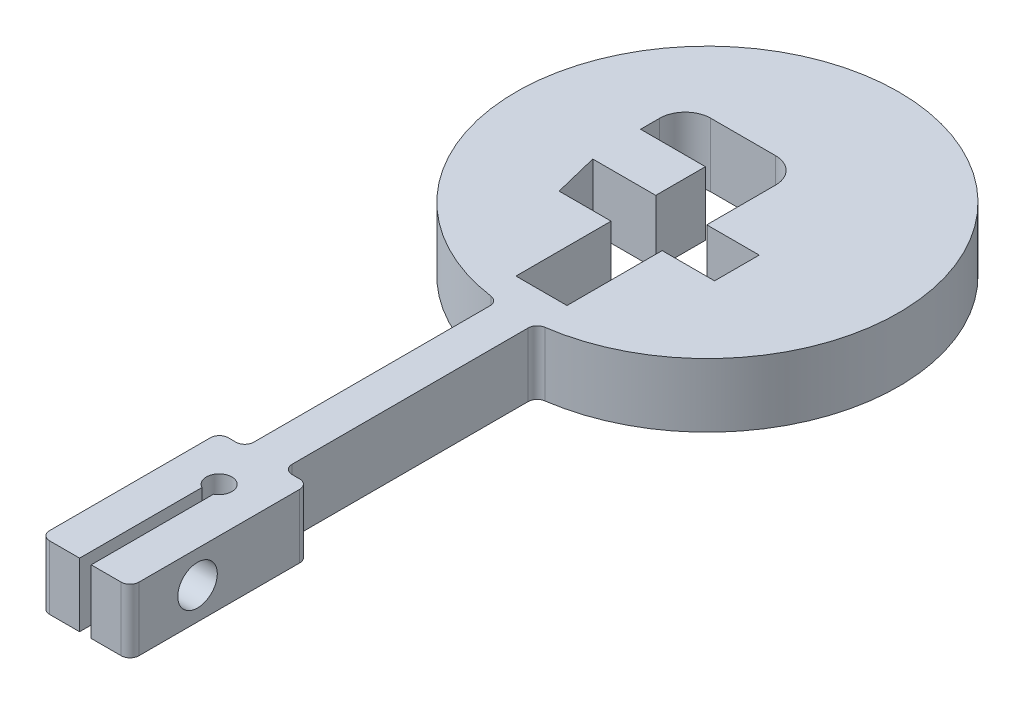
from build123d import *

# Parameters (mm, degrees)
BOSS_EXTRUDE2_DEPTH = 5
SKETCH5_R           = 1.55
CUT_EXTRUDE1_DEPTH  = 60.905859109
FILLET6_R           = 0.7
FILLET7_R           = 0.7
FILLET8_R           = 0.7
FILLET9_R           = 0.7
FILLET10_R          = 0.7
FILLET11_R          = 0.7
FILLET12_R          = 0.7
FILLET13_R          = 0.7
FILLET14_R          = 2
FILLET15_R          = 2


with BuildPart() as part:
    # Sketch3 → Boss-Extrude2 (new body)
    with BuildSketch(Plane(origin=(0, 0, 0), x_dir=(1, 0, 0), z_dir=(0, 1, 0))):
        with BuildLine():
            Line((0.454624582, 2.591384664), (0.454624582, -7))
            Line((0.454624582, -7), (3.5, -7))
            Line((3.5, -7), (3.5, 7))
            Line((3.5, 7), (1.5, 7))
            Line((1.5, 7), (1.5, 26.833112609))
            ThreePointArc((1.5, 26.833112609), (0, 56.757924165), (-1.5, 26.833112609))
            Line((-1.5, 26.833112609), (-1.5, 7))
            Line((-1.5, 7), (-3.5, 7))
            Line((-3.5, 7), (-3.5, -7))
            Line((-3.5, -7), (-0.454624582, -7))
            Line((-0.454624582, -7), (-0.454624582, 2.591384664))
            ThreePointArc((-0.454624582, 2.591384664), (0, 4.482067823), (0.454624582, 2.591384664))
        make_face()
        Polygon((1.5, 36.708863036), (1.5, 29.251163785), (-2.5, 29.251163785), (-2.5, 36.708863036), (-6.573288639, 36.708863036), (-7.435532145, 40.208863036), (-2.5, 40.208863036), (-2.5, 44.101325286), (-7.582366619, 44.101325286), (-7.582366619, 47.601325286), (1.5, 47.601325286), (1.5, 40.208863036), (5.609756824, 40.208863036), (5.609756824, 36.708863036), align=None, mode=Mode.SUBTRACT)
    extrude(amount=BOSS_EXTRUDE2_DEPTH)

    # Sketch5 → Cut-Extrude1 (cut, through all)
    with BuildSketch(Plane.ZY.offset(3.5)):
        with Locations((1.710892138, 2.5)):
            Circle(SKETCH5_R)
    extrude(amount=-CUT_EXTRUDE1_DEPTH, mode=Mode.SUBTRACT)

    # Fillet6
    fillet6_edges = [part.edges().sort_by_distance(p)[0] for p in [
        (1.5, 2.5, -7),
    ]]
    fillet(fillet6_edges, radius=FILLET6_R)

    # Fillet7
    fillet7_edges = [part.edges().sort_by_distance(p)[0] for p in [
        (3.5, 2.5, -7),
    ]]
    fillet(fillet7_edges, radius=FILLET7_R)

    # Fillet8
    fillet8_edges = [part.edges().sort_by_distance(p)[0] for p in [
        (-1.5, 2.5, -7),
    ]]
    fillet(fillet8_edges, radius=FILLET8_R)

    # Fillet9
    fillet9_edges = [part.edges().sort_by_distance(p)[0] for p in [
        (-3.5, 2.5, -7),
    ]]
    fillet(fillet9_edges, radius=FILLET9_R)

    # Fillet10
    fillet10_edges = [part.edges().sort_by_distance(p)[0] for p in [
        (3.5, 2.5, 7),
    ]]
    fillet(fillet10_edges, radius=FILLET10_R)

    # Fillet11
    fillet11_edges = [part.edges().sort_by_distance(p)[0] for p in [
        (-3.5, 2.5, 7),
    ]]
    fillet(fillet11_edges, radius=FILLET11_R)

    # Fillet12
    fillet12_edges = [part.edges().sort_by_distance(p)[0] for p in [
        (1.5, 2.5, -26.833112609),
    ]]
    fillet(fillet12_edges, radius=FILLET12_R)

    # Fillet13
    fillet13_edges = [part.edges().sort_by_distance(p)[0] for p in [
        (-1.5, 2.5, -26.833112609),
    ]]
    fillet(fillet13_edges, radius=FILLET13_R)

    # Fillet14
    fillet14_edges = [part.edges().sort_by_distance(p)[0] for p in [
        (1.5, 2.5, -47.601325286),
    ]]
    fillet(fillet14_edges, radius=FILLET14_R)

    # Fillet15
    fillet15_edges = [part.edges().sort_by_distance(p)[0] for p in [
        (-7.582366619, 2.5, -47.601325286),
    ]]
    fillet(fillet15_edges, radius=FILLET15_R)


solid = part.part
